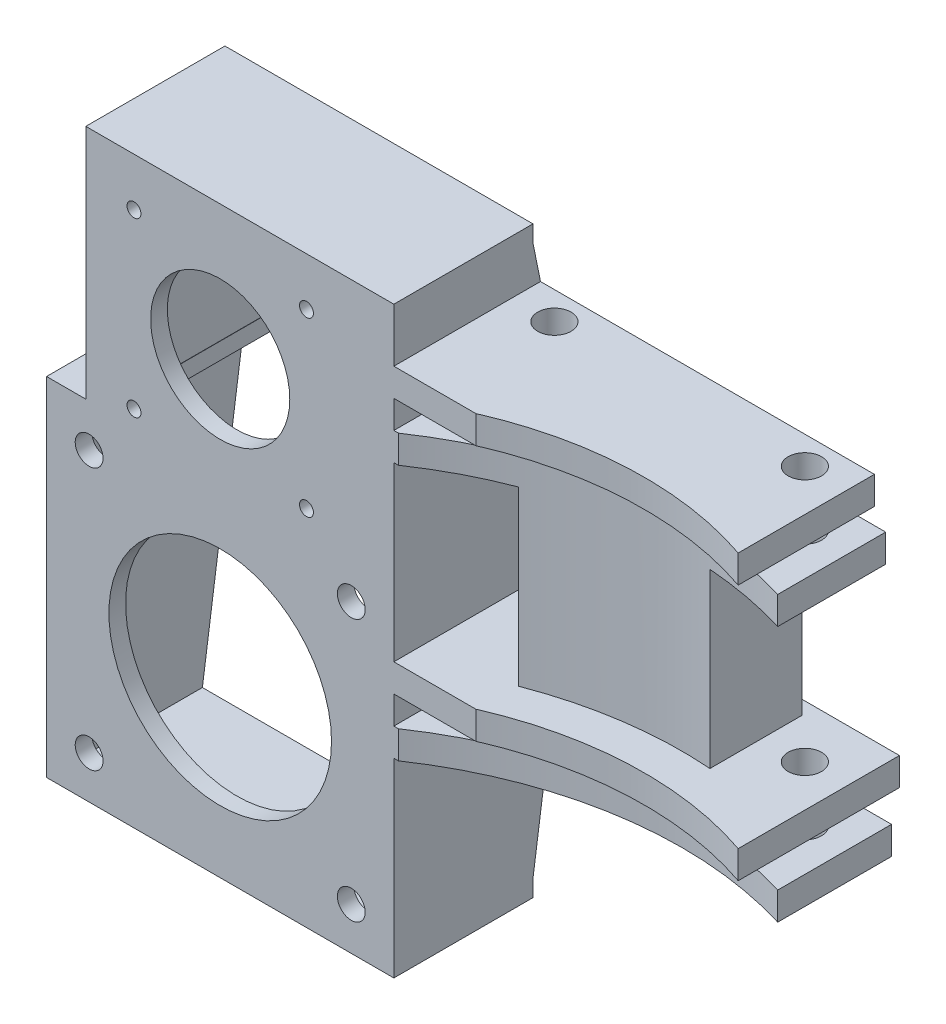
from build123d import *

# Parameters (mm, degrees)
SKETCH1_W               = 56.4
SKETCH1_H               = 56.4
SKETCH1_R               = 2.5
SKETCH1_R_2             = 20
SKETCH1_W_2             = 42.3
SKETCH1_H_2             = 42.45
SKETCH1_R_3             = 1.25
SKETCH1_R_4             = 12.5
BOSS_EXTRUDE1_DEPTH     = 3
BOSS_EXTRUDE2_DEPTH     = 3
BOSS_EXTRUDE3_DEPTH     = 3
BOSS_EXTRUDE4_DEPTH     = 3
BOSS_EXTRUDE5_DEPTH     = 7.05
SKETCH6_W               = 62.4
SKETCH6_H               = 25
BOSS_EXTRUDE6_DEPTH     = 3
SKETCH7_W               = 55.35
SKETCH7_H               = 25
BOSS_EXTRUDE7_DEPTH     = 3
SKETCH8_W               = 26.348542459
SKETCH8_H               = 5
SKETCH8_W_2             = 28.376425856
SKETCH8_W_3             = 30.843971631
SKETCH8_W_4             = 29.425531915
BOSS_EXTRUDE8_DEPTH     = 60
SKETCH9_R               = 69.252729773
SKETCH9_R_2             = 19.252729773
CUT_EXTRUDE1_DEPTH      = 5
CUT_EXTRUDE2_START      = -51
SKETCH9_2_R             = 69.252729773
SKETCH9_2_R_2           = 19.252729773
CUT_EXTRUDE2_DEPTH      = 5
CUT_EXTRUDE3_DEPTH      = 136.205325339
CUT_EXTRUDE3_DEPTH_BACK = 136.205325339
SKETCH10_R              = 62.5
BOSS_EXTRUDE9_DEPTH     = 31
CUT_EXTRUDE4_DEPTH      = 129.360741662
CUT_EXTRUDE4_DEPTH_BACK = 129.360741662
SKETCH12_R              = 3


with BuildPart() as part:
    # Sketch1 → Boss-Extrude1 (new body)
    # profile 1 of 2: a face of its own
    with BuildSketch(Plane.XY):
        Rectangle(SKETCH1_W, SKETCH1_H)
        with Locations((-23.55, -23.55)):
            Circle(SKETCH1_R, mode=Mode.SUBTRACT)
        with Locations((-23.55, 23.55)):
            Circle(SKETCH1_R, mode=Mode.SUBTRACT)
        with Locations((23.55, 23.55)):
            Circle(SKETCH1_R, mode=Mode.SUBTRACT)
        with Locations((23.55, -23.55)):
            Circle(SKETCH1_R, mode=Mode.SUBTRACT)
        Circle(SKETCH1_R_2, mode=Mode.SUBTRACT)
    # profile 2 of 2: a face of its own
    with BuildSketch(Plane.XY):
        with Locations((0, 49.425)):
            Rectangle(SKETCH1_W_2, SKETCH1_H_2)
        with Locations((-15.49, 34)):
            Circle(SKETCH1_R_3, mode=Mode.SUBTRACT)
        with Locations((-15.49, 64.99)):
            Circle(SKETCH1_R_3, mode=Mode.SUBTRACT)
        with Locations((15.5, 64.99)):
            Circle(SKETCH1_R_3, mode=Mode.SUBTRACT)
        with Locations((15.5, 34)):
            Circle(SKETCH1_R_3, mode=Mode.SUBTRACT)
        with Locations((0, 49.5)):
            Circle(SKETCH1_R_4, mode=Mode.SUBTRACT)
    extrude(amount=BOSS_EXTRUDE1_DEPTH)

    # Sketch2 → Boss-Extrude2 (add)
    with BuildSketch(Plane.ZY.offset(28.2)):
        Polygon((-22, -28.2), (-30, 28.2), (0, 28.2), (3, 28.2), (3, -28.2), align=None)
    boss_extrude2 = extrude(amount=BOSS_EXTRUDE2_DEPTH)

    # Mirror1: Boss-Extrude2 across plane
    add(boss_extrude2.mirror(Plane(origin=(0, 0, 0), x_dir=(0, 0, 1), z_dir=(1, 0, 0))))

    # Sketch3 → Boss-Extrude3 (add)
    with BuildSketch(Plane(origin=(0, 28.2, 0), x_dir=(1, 0, 0), z_dir=(0, 1, 0))):
        Polygon((-21.1, 30), (-31.2, 30), (-31.2, -3), (31.2, -3), (31.2, 30), (21.1, 30), (21.1, 0), (-21.1, 0), align=None)
    extrude(amount=BOSS_EXTRUDE3_DEPTH)

    # Sketch4 → Boss-Extrude4 (add)
    with BuildSketch(Plane(origin=(21.15, 0, 0), x_dir=(0, 0, -1), z_dir=(1, 0, 0))):
        Polygon((30, 31.2), (22, 70.65), (-3, 70.65), (-3, 31.2), align=None)
    boss_extrude4 = extrude(amount=BOSS_EXTRUDE4_DEPTH)

    # Mirror2: Boss-Extrude4 across plane
    add(boss_extrude4.mirror(Plane(origin=(0, 0, 0), x_dir=(0, 0, 1), z_dir=(1, 0, 0))))

    # Sketch5 → Boss-Extrude5 (add)
    with BuildSketch(Plane(origin=(24.15, 0, 0), x_dir=(0, 0, -1), z_dir=(1, 0, 0))):
        Polygon((-3, 31.2), (30, 31.2), (22, 70.65), (-3, 70.65), align=None)
    extrude(amount=BOSS_EXTRUDE5_DEPTH)

    # Sketch6 → Boss-Extrude6 (add)
    with BuildSketch(Plane.XZ.offset(28.2)):
        with Locations((0, -9.5)):
            Rectangle(SKETCH6_W, SKETCH6_H)
    extrude(amount=BOSS_EXTRUDE6_DEPTH)

    # Sketch7 → Boss-Extrude7 (add)
    with BuildSketch(Plane(origin=(0, 70.65, 0), x_dir=(1, 0, 0), z_dir=(0, 1, 0))):
        with Locations((3.525, 9.5)):
            Rectangle(SKETCH7_W, SKETCH7_H)
    extrude(amount=BOSS_EXTRUDE7_DEPTH)

    # Sketch8 → Boss-Extrude8 (add)
    with BuildSketch(Plane(origin=(31.2, 0, 0), x_dir=(0, 0, -1), z_dir=(1, 0, 0))):
        with Locations((10.17427123, 61.5)):
            Rectangle(SKETCH8_W, SKETCH8_H)
        with Locations((11.188212928, 51.5)):
            Rectangle(SKETCH8_W_2, SKETCH8_H)
        with Locations((12.421985816, 15.5)):
            Rectangle(SKETCH8_W_3, SKETCH8_H)
        with Locations((11.712765958, 5.5)):
            Rectangle(SKETCH8_W_4, SKETCH8_H)
    extrude(amount=BOSS_EXTRUDE8_DEPTH)

    # Sketch9 → Cut-Extrude1 (cut)
    with BuildSketch(Plane(origin=(0, 54, 0), x_dir=(1, 0, 0), z_dir=(0, 1, 0))):
        with Locations((70.970898887, -60.264609649)):
            Circle(SKETCH9_R)
        with Locations((70.970898887, -60.264609649)):
            Circle(SKETCH9_R_2, mode=Mode.SUBTRACT)
    extrude(amount=-CUT_EXTRUDE1_DEPTH, mode=Mode.SUBTRACT)

    # Sketch9<2> → Cut-Extrude2 (cut)
    with BuildSketch(Plane(origin=(0, 54, 0), x_dir=(1, 0, 0), z_dir=(0, 1, 0)).offset(CUT_EXTRUDE2_START)):
        with Locations((70.970898887, -60.264609649)):
            Circle(SKETCH9_2_R)
        with Locations((70.970898887, -60.264609649)):
            Circle(SKETCH9_2_R_2, mode=Mode.SUBTRACT)
    extrude(amount=CUT_EXTRUDE2_DEPTH, mode=Mode.SUBTRACT)

    # Sketch10 → Cut-Extrude3 (cut, two sides: drawn at the far end of the back side and taken through both)
    with BuildSketch(Plane(origin=(0, 64, 0), x_dir=(1, 0, 0), z_dir=(0, 1, 0)).offset(-CUT_EXTRUDE3_DEPTH_BACK)):
        with Locations((70.970898887, -60.264609649)):
            Circle(SKETCH10_R)
    extrude(amount=CUT_EXTRUDE3_DEPTH + CUT_EXTRUDE3_DEPTH_BACK, mode=Mode.SUBTRACT)

    # Sketch11 → Boss-Extrude9 (add)
    with BuildSketch(Plane.XZ.offset(-49)):
        with BuildLine():
            Line((46.2, -25.376425856), (76.2, -25.376425856))
            Line((76.2, -25.376425856), (76.2, -8.790419729))
            ThreePointArc((76.2, -8.790419729), (60.957142835, -8.260314799), (46.2, -4.406428299))
            Line((46.2, -4.406428299), (46.2, -25.376425856))
        make_face()
    extrude(amount=BOSS_EXTRUDE9_DEPTH)

    # Sketch12 → Cut-Extrude4 (cut, two sides: drawn at the far end of the back side and taken through both)
    with BuildSketch(Plane(origin=(0, 54, 0), x_dir=(1, 0, 0), z_dir=(0, 1, 0)).offset(-CUT_EXTRUDE4_DEPTH_BACK)):
        with Locations(Location((83.7, 18.348542459, 0), (0, 0, 180))):
            Circle(SKETCH12_R)
        with Locations(Location((38.7, 18.348542459, 0), (0, 0, 180))):
            Circle(SKETCH12_R)
    extrude(amount=CUT_EXTRUDE4_DEPTH + CUT_EXTRUDE4_DEPTH_BACK, mode=Mode.SUBTRACT)


solid = part.part
